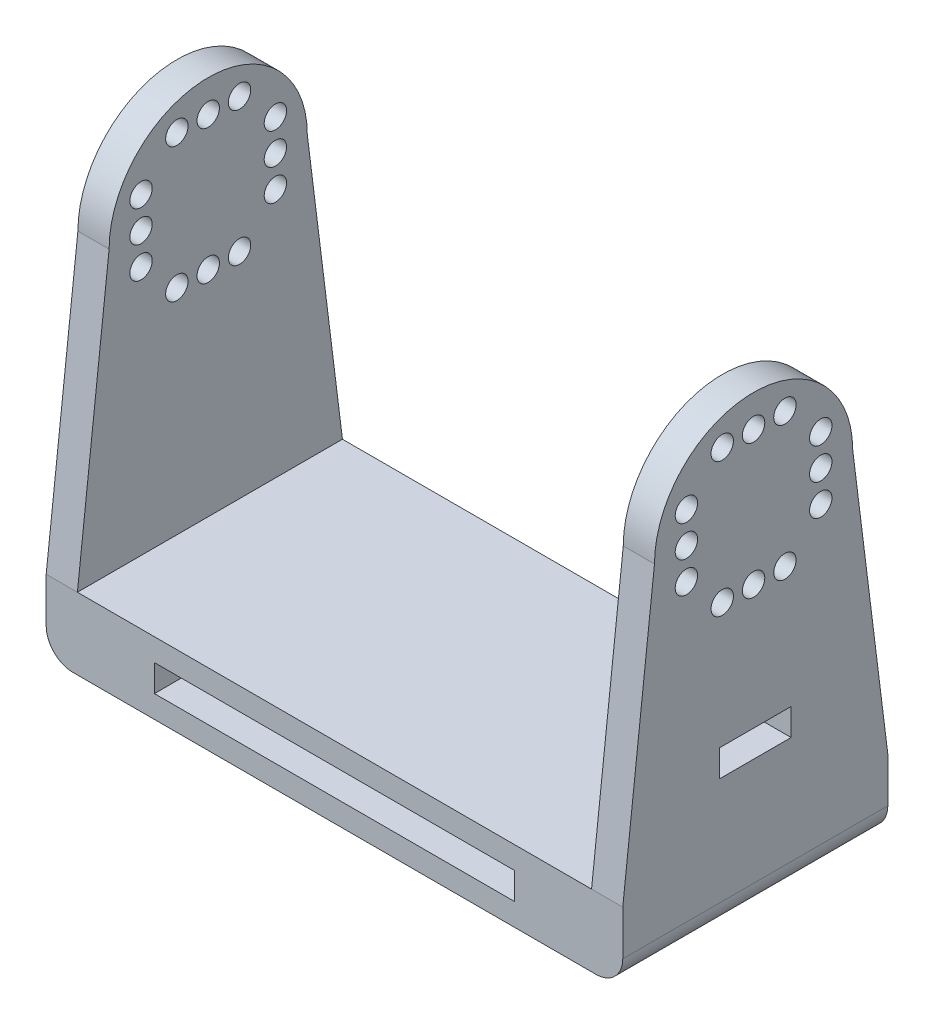
from build123d import *

# Parameters (mm, degrees)
SKETCH2_W           = 64.37
SKETCH2_H           = 29.59
BOSS_EXTRUDE1_DEPTH = 8
SKETCH3_W           = 3.485
SKETCH3_H           = 29.59
BOSS_EXTRUDE2_DEPTH = 50
FILLET2_R           = 3
SKETCH4_R           = 1.25
CUT_EXTRUDE8_DEPTH  = 70
SKETCH27_W          = 40.2
SKETCH27_H          = 3
CUT_EXTRUDE14_DEPTH = 12.295
SKETCH30_W          = 40.2
SKETCH30_H          = 3
CUT_EXTRUDE15_DEPTH = 12.295
SKETCH12_W          = 4
SKETCH12_H          = 3
CUT_EXTRUDE16_DEPTH = 60


with BuildPart() as part:
    # Sketch2 → Boss-Extrude1 (new body)
    with BuildSketch(Plane(origin=(0, 0, 0), x_dir=(1, 0, 0), z_dir=(0, 1, 0))):
        with Locations((-20.263080223, 14.424105874)):
            Rectangle(SKETCH2_W, SKETCH2_H)
    extrude(amount=BOSS_EXTRUDE1_DEPTH)

    # Sketch3 → Boss-Extrude2 (add)
    with BuildSketch(Plane(origin=(0, 8, 0), x_dir=(1, 0, 0), z_dir=(0, 1, 0))):
        with Locations((-50.705580223, 14.424105874)):
            Rectangle(SKETCH3_W, SKETCH3_H)
        with Locations((10.179419777, 14.424105874)):
            Rectangle(SKETCH3_W, SKETCH3_H)
    extrude(amount=BOSS_EXTRUDE2_DEPTH)

    # Fillet2
    fillet2_edges = [part.edges().sort_by_distance(p)[0] for p in [
        (11.921919777, 0, -14.424105874),
        (-52.448080223, 0, -14.424105874),
    ]]
    fillet(fillet2_edges, radius=FILLET2_R)

    # Sketch4 → Cut-Extrude8 (cut)
    with BuildSketch(Plane.ZY.offset(52.448080223)):
        with BuildLine():
            Line((-29.219105874, 8), (-25.296901218, 39.40325627))
            ThreePointArc((-25.296901218, 39.40325627), (-14.233202156, 50.466955332), (-3.169503094, 39.40325627))
            Line((-3.169503094, 39.40325627), (0.370894126, 8))
            Line((0.370894126, 8), (0.370894126, 58))
            Line((0.370894126, 58), (-29.219105874, 58))
            Line((-29.219105874, 58), (-29.219105874, 8))
        make_face()
        with Locations((-21.733202156, 42.90325627)):
            Circle(SKETCH4_R)
        with Locations((-21.733202156, 39.40325627)):
            Circle(SKETCH4_R)
        with Locations((-21.733202156, 35.90325627)):
            Circle(SKETCH4_R)
        with Locations((-17.733202156, 31.90325627)):
            Circle(SKETCH4_R)
        with Locations((-10.733202156, 31.90325627)):
            Circle(SKETCH4_R)
        with Locations((-6.733202156, 35.90325627)):
            Circle(SKETCH4_R)
        with Locations((-6.733202156, 39.40325627)):
            Circle(SKETCH4_R)
        with Locations((-6.733202156, 42.90325627)):
            Circle(SKETCH4_R)
        with Locations((-10.733202156, 46.90325627)):
            Circle(SKETCH4_R)
        with Locations((-17.733202156, 46.90325627)):
            Circle(SKETCH4_R)
        with Locations((-14.233202156, 46.90325627)):
            Circle(SKETCH4_R)
        with Locations((-14.233202156, 31.90325627)):
            Circle(SKETCH4_R)
    extrude(amount=-CUT_EXTRUDE8_DEPTH, mode=Mode.SUBTRACT)

    # Sketch27 → Cut-Extrude14 (cut)
    with BuildSketch(Plane.XY.offset(0.370894126)):
        with Locations((-20.263080223, 4)):
            Rectangle(SKETCH27_W, SKETCH27_H)
    extrude(amount=-CUT_EXTRUDE14_DEPTH, mode=Mode.SUBTRACT)

    # Sketch30 → Cut-Extrude15 (cut)
    with BuildSketch(Plane(origin=(0, 0, -29.219105874), x_dir=(-1, 0, 0), z_dir=(0, 0, -1))):
        with Locations((20.263080223, 4)):
            Rectangle(SKETCH30_W, SKETCH30_H)
    extrude(amount=-CUT_EXTRUDE15_DEPTH, mode=Mode.SUBTRACT)

    # Sketch12 → Cut-Extrude16 (cut)
    with BuildSketch(Plane(origin=(11.921919777, 0, 0), x_dir=(0, 0, -1), z_dir=(1, 0, 0))):
        with Locations((12.424105874, 16.5)):
            Rectangle(SKETCH12_W, SKETCH12_H)
        with Locations((16.424105874, 16.5)):
            Rectangle(SKETCH12_W, SKETCH12_H)
    extrude(amount=-CUT_EXTRUDE16_DEPTH, mode=Mode.SUBTRACT)


solid = part.part
